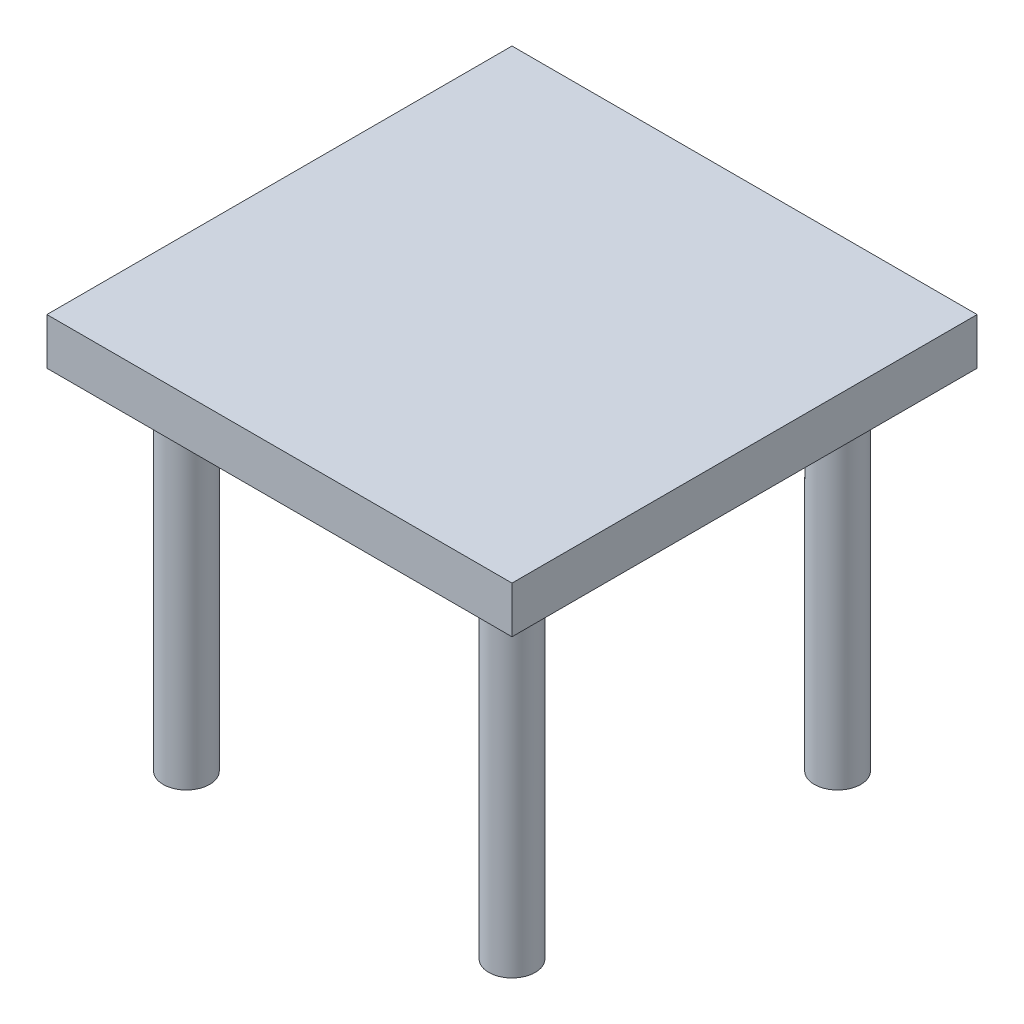
from build123d import *

# Parameters (mm, degrees)
SKETCH_1_W      = 200
SKETCH_1_H      = 200
EXTRUDE_1_DEPTH = 20
SKETCH_2_R      = 10
EXTRUDE_2_DEPTH = 152


with BuildPart() as part:
    # 草图1 → 凸台-拉伸1 (new body)
    with BuildSketch(Plane(origin=(0, 150, 0), x_dir=(1, 0, 0), z_dir=(0, 1, 0))):
        Rectangle(SKETCH_1_W, SKETCH_1_H)
    extrude(amount=EXTRUDE_1_DEPTH)

    # 草图2 → 凸台-拉伸2 (add)
    with BuildSketch(Plane(origin=(0, 152, 0), x_dir=(1, 0, 0), z_dir=(0, 1, 0))):
        with Locations(Location((-70, 70, 0), (0, 0, 270))):
            Circle(SKETCH_2_R)
        with Locations(Location((70, 70, 0), (0, 0, 270))):
            Circle(SKETCH_2_R)
        with Locations(Location((-70, -70, 0), (0, 0, 270))):
            Circle(SKETCH_2_R)
        with Locations(Location((70, -70, 0), (0, 0, 270))):
            Circle(SKETCH_2_R)
    extrude(amount=-EXTRUDE_2_DEPTH)


solid = part.part
